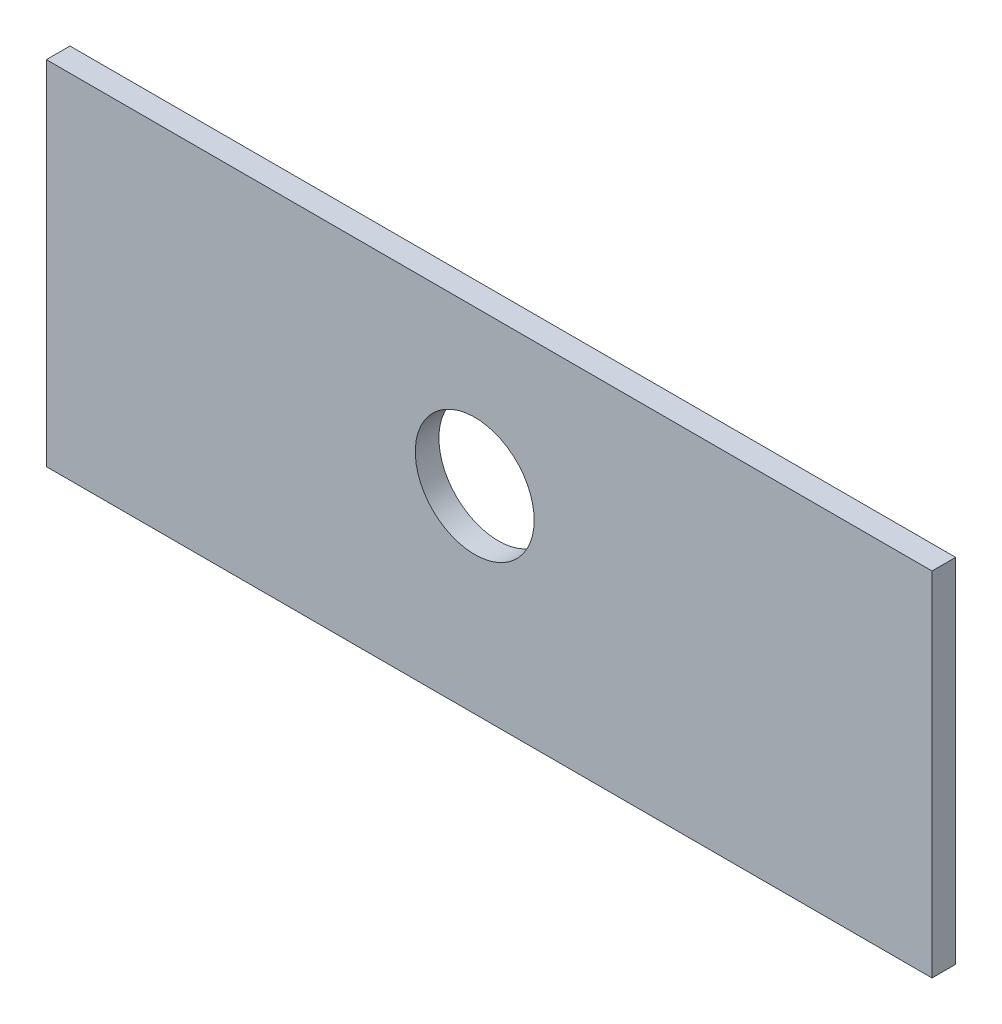
from build123d import *

# Parameters (mm, degrees)
SKETCH1_R           = 5.034687392
BOSS_EXTRUDE1_DEPTH = 2


with BuildPart() as part:
    # Sketch1 → Boss-Extrude1 (new body)
    with BuildSketch(Plane.XY):
        Polygon((29.741294814, 7.540555765), (-45.258705186, 7.540555765), (-45.258705186, 37.390988743), (29.741294814, 37.390955861), align=None)
        with Locations((-8.98326267, 24.266867238)):
            Circle(SKETCH1_R, mode=Mode.SUBTRACT)
    extrude(amount=BOSS_EXTRUDE1_DEPTH)


solid = part.part
